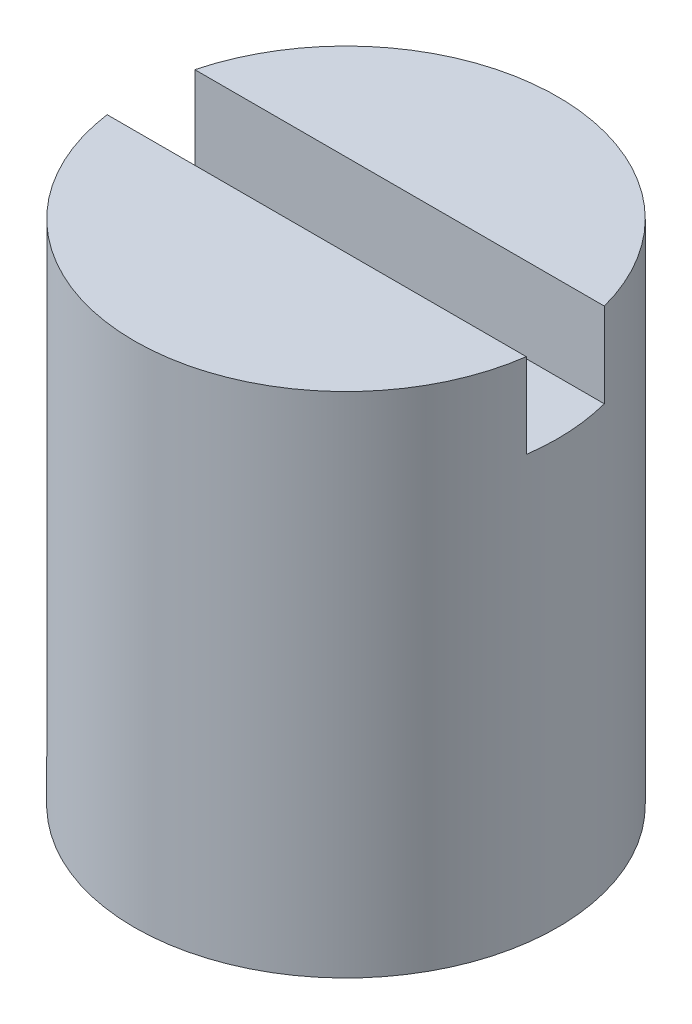
from build123d import *

# Parameters (mm, degrees)
SKETCH1_R           = 7.5
BOSS_EXTRUDE1_DEPTH = 18
SKETCH2_W           = 24.164210644
SKETCH2_H           = 2.935838677
CUT_EXTRUDE1_DEPTH  = 3


with BuildPart() as part:
    # Sketch1 → Boss-Extrude1 (new body)
    with BuildSketch(Plane(origin=(0, 0, 0), x_dir=(1, 0, 0), z_dir=(0, 1, 0))):
        with Locations(Location((0, 0, 0), (0, 0, 270))):
            Circle(SKETCH1_R)
    extrude(amount=BOSS_EXTRUDE1_DEPTH)

    # Sketch2 → Cut-Extrude1 (cut)
    with BuildSketch(Plane(origin=(0, 18, 0), x_dir=(1, 0, 0), z_dir=(0, 1, 0))):
        with Locations((-0.598960247, 0.431137149)):
            Rectangle(SKETCH2_W, SKETCH2_H)
    extrude(amount=-CUT_EXTRUDE1_DEPTH, mode=Mode.SUBTRACT)


solid = part.part
